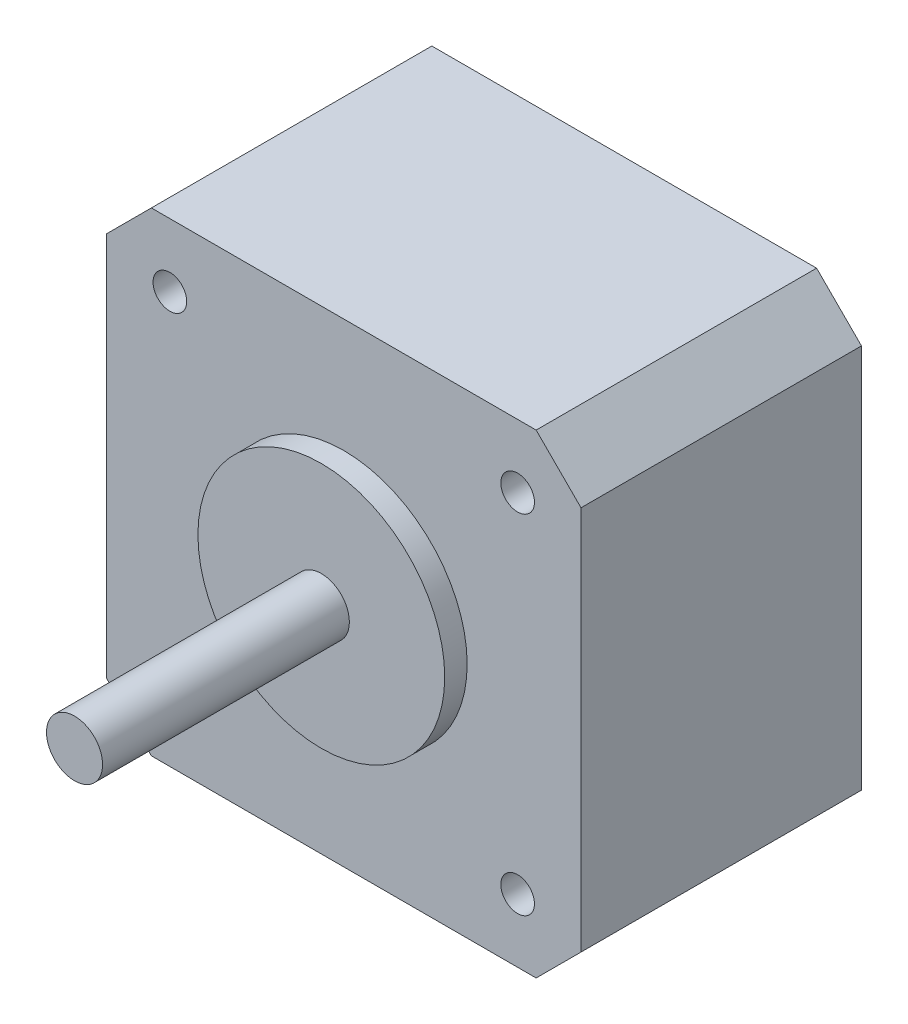
from build123d import *

# Parameters (mm, degrees)
SKETCH1_W           = 42.3
SKETCH1_H           = 42.3
BOSS_EXTRUDE1_DEPTH = 25
SKETCH2_R           = 1.5
CUT_EXTRUDE1_DEPTH  = 6
SKETCH3_R           = 11
BOSS_EXTRUDE2_DEPTH = 2
SKETCH4_R           = 2.5
BOSS_EXTRUDE3_DEPTH = 22
CHAMFER1_SIZE       = 4


with BuildPart() as part:
    # Sketch1 → Boss-Extrude1 (new body)
    with BuildSketch(Plane.XY):
        Rectangle(SKETCH1_W, SKETCH1_H)
    extrude(amount=-BOSS_EXTRUDE1_DEPTH)

    # Sketch2 → Cut-Extrude1 (cut)
    with BuildSketch(Plane.XY):
        with Locations((-15.5, 15.5)):
            Circle(SKETCH2_R)
        with Locations((15.5, 15.5)):
            Circle(SKETCH2_R)
        with Locations((15.5, -15.5)):
            Circle(SKETCH2_R)
        with Locations((-15.5, -15.5)):
            Circle(SKETCH2_R)
    extrude(amount=-CUT_EXTRUDE1_DEPTH, mode=Mode.SUBTRACT)

    # Sketch3 → Boss-Extrude2 (add)
    with BuildSketch(Plane.XY):
        Circle(SKETCH3_R)
    extrude(amount=BOSS_EXTRUDE2_DEPTH)

    # Sketch4 → Boss-Extrude3 (add)
    with BuildSketch(Plane.XY.offset(2)):
        Circle(SKETCH4_R)
    extrude(amount=BOSS_EXTRUDE3_DEPTH)

    # Chamfer1
    chamfer1_edges = [part.edges().sort_by_distance(p)[0] for p in [
        (21.15, -21.15, -12.5),
        (-21.15, -21.15, -12.5),
        (-21.15, 21.15, -12.5),
        (21.15, 21.15, -12.5),
    ]]
    chamfer(chamfer1_edges, length=CHAMFER1_SIZE)


solid = part.part
